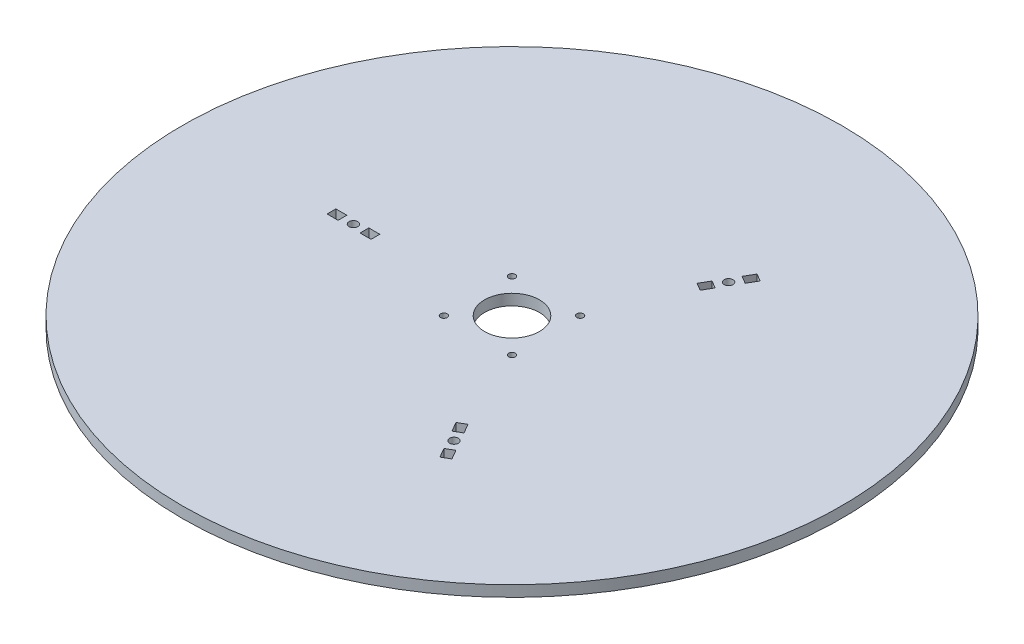
from build123d import *

# Parameters (mm, degrees)
SKETCH_1_R      = 150
SKETCH_1_R_2    = 1.5
SKETCH_1_R_3    = 12.5
SKETCH_1_R_4    = 2
SKETCH_1_W      = 5
SKETCH_1_H      = 4
EXTRUDE_1_DEPTH = 5


with BuildPart() as part:
    # 草图1 → 凸台-拉伸1 (new body)
    with BuildSketch(Plane(origin=(0, 0, 0), x_dir=(1, 0, 0), z_dir=(0, 1, 0))):
        with Locations(Location((0, 0, 0), (0, 0, 270))):
            Circle(SKETCH_1_R)
        with Locations(Location((-15.5, 15.5, 0), (0, 0, 270))):
            Circle(SKETCH_1_R_2, mode=Mode.SUBTRACT)
        with Locations(Location((15.5, 15.5, 0), (0, 0, 270))):
            Circle(SKETCH_1_R_2, mode=Mode.SUBTRACT)
        with Locations(Location((15.5, -15.5, 0), (0, 0, 270))):
            Circle(SKETCH_1_R_2, mode=Mode.SUBTRACT)
        with Locations(Location((-15.5, -15.5, 0), (0, 0, 270))):
            Circle(SKETCH_1_R_2, mode=Mode.SUBTRACT)
        with Locations(Location((0, 0, 0), (0, 0, 270))):
            Circle(SKETCH_1_R_3, mode=Mode.SUBTRACT)
        with Locations(Location((-72.168783649, 0, 0), (0, 0, 270))):
            Circle(SKETCH_1_R_4, mode=Mode.SUBTRACT)
        with Locations(Location((36.084391824, 62.5, 0), (0, 0, 270))):
            Circle(SKETCH_1_R_4, mode=Mode.SUBTRACT)
        with Locations(Location((36.084391824, -62.5, 0), (0, 0, 270))):
            Circle(SKETCH_1_R_4, mode=Mode.SUBTRACT)
        Polygon((36.852341017, 67.830127019), (40.316442632, 65.830127019), (42.816442632, 70.160254038), (39.352341017, 72.160254038), align=None, mode=Mode.SUBTRACT)
        with Locations((-64.668783649, 0)):
            Rectangle(SKETCH_1_W, SKETCH_1_H, mode=Mode.SUBTRACT)
        with Locations((-79.668783649, 0)):
            Rectangle(SKETCH_1_W, SKETCH_1_H, mode=Mode.SUBTRACT)
        Polygon((29.352341017, 54.839745962), (32.816442632, 52.839745962), (35.316442632, 57.169872981), (31.852341017, 59.169872981), align=None, mode=Mode.SUBTRACT)
        Polygon((40.316442632, -65.830127019), (36.852341017, -67.830127019), (39.352341017, -72.160254038), (42.816442632, -70.160254038), align=None, mode=Mode.SUBTRACT)
        Polygon((32.816442632, -52.839745962), (29.352341017, -54.839745962), (31.852341017, -59.169872981), (35.316442632, -57.169872981), align=None, mode=Mode.SUBTRACT)
    extrude(amount=EXTRUDE_1_DEPTH)


solid = part.part
